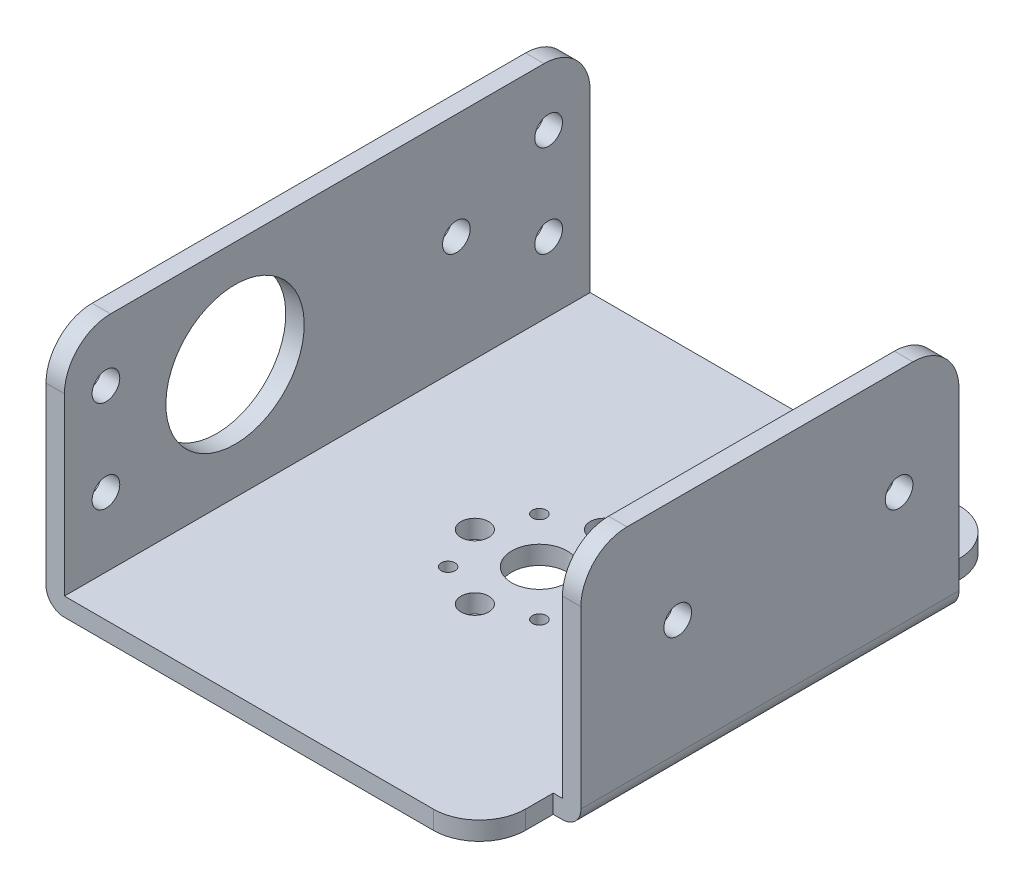
from build123d import *

# Parameters (mm, degrees)
EXTRUDE_1_DEPTH     = 57
SKETCH_2_R          = 7.5
SKETCH_2_R_2        = 1.5
CUT_EXTRUDE_1_DEPTH = 27
SKETCH_3_R          = 1.5
CUT_EXTRUDE_2_DEPTH = 10
SKETCH_4_R          = 1.5
SKETCH_4_R_2        = 3
SKETCH_4_R_3        = 0.75
CUT_EXTRUDE_3_DEPTH = 10
SKETCH_5_R          = 1.5
CUT_EXTRUDE_4_DEPTH = 3
FILLET_2_R          = 2
SKETCH_6_W          = 3
SKETCH_6_H          = 8
CUT_EXTRUDE_5_DEPTH = 44
FILLET_3_R          = 5


with BuildPart() as part:
    # 草图1 → 凸台-拉伸1 (new body)
    with BuildSketch(Plane.XY):
        Polygon((0, 0), (0, -26), (50, -26), (50, 0), (48, 0), (48, -24), (2, -24), (2, 0), align=None)
    extrude(amount=EXTRUDE_1_DEPTH)

    # 草图2 → 切除-拉伸1 (cut)
    with BuildSketch(Plane.ZY):
        with Locations(Location((38.5, -11.5, 0), (0, 0, 270))):
            Circle(SKETCH_2_R)
        with Locations(Location((14.5, -11.5, 0), (0, 0, 270))):
            Circle(SKETCH_2_R_2)
    extrude(amount=-CUT_EXTRUDE_1_DEPTH, mode=Mode.SUBTRACT)

    # 草图3 → 切除-拉伸2 (cut)
    with BuildSketch(Plane(origin=(2, 0, 0), x_dir=(0, 0, -1), z_dir=(1, 0, 0))):
        with Locations(Location((-4.5, -6.5, 0), (0, 0, 90))):
            Circle(SKETCH_3_R)
        with Locations(Location((-4.5, -16.5, 0), (0, 0, 90))):
            Circle(SKETCH_3_R)
        with Locations(Location((-52.5, -16.5, 0), (0, 0, 90))):
            Circle(SKETCH_3_R)
        with Locations(Location((-52.5, -6.5, 0), (0, 0, 90))):
            Circle(SKETCH_3_R)
    extrude(amount=-CUT_EXTRUDE_2_DEPTH, mode=Mode.SUBTRACT)

    # 草图4 → 切除-拉伸3 (cut)
    with BuildSketch(Plane(origin=(0, -24, 0), x_dir=(1, 0, 0), z_dir=(0, 1, 0))):
        with Locations(Location((18, -28.5, 0), (0, 0, 270))):
            Circle(SKETCH_4_R)
        with Locations(Location((25, -21.5, 0), (0, 0, 270))):
            Circle(SKETCH_4_R)
        with Locations(Location((32, -28.5, 0), (0, 0, 270))):
            Circle(SKETCH_4_R)
        with Locations(Location((25, -35.5, 0), (0, 0, 270))):
            Circle(SKETCH_4_R)
        with Locations(Location((25, -28.5, 0), (0, 0, 270))):
            Circle(SKETCH_4_R_2)
        with Locations(Location((20.050252532, -23.550252532, 0), (0, 0, 270))):
            Circle(SKETCH_4_R_3)
        with Locations(Location((29.949747468, -23.550252532, 0), (0, 0, 270))):
            Circle(SKETCH_4_R_3)
        with Locations(Location((29.949747468, -33.449747468, 0), (0, 0, 270))):
            Circle(SKETCH_4_R_3)
        with Locations(Location((20.050252532, -33.449747468, 0), (0, 0, 270))):
            Circle(SKETCH_4_R_3)
    extrude(amount=-CUT_EXTRUDE_3_DEPTH, mode=Mode.SUBTRACT)

    # 草图5 → 切除-拉伸4 (cut)
    with BuildSketch(Plane.ZY.offset(-48)):
        with Locations(Location((14.5, -11.5, 0), (0, 0, 270))):
            Circle(SKETCH_5_R)
        with Locations(Location((38.5, -11.5, 0), (0, 0, 270))):
            Circle(SKETCH_5_R)
    extrude(amount=-CUT_EXTRUDE_4_DEPTH, mode=Mode.SUBTRACT)

    # 圆角2
    fillet_2_edges = [part.edges().sort_by_distance(p)[0] for p in [
        (50, -26, 28.5),
        (0, -26, 28.5),
    ]]
    fillet(fillet_2_edges, radius=FILLET_2_R)

    # 草图6 → 切除-拉伸5 (cut)
    with BuildSketch(Plane.XZ.offset(26)):
        with Locations((48.5, 53)):
            Rectangle(SKETCH_6_W, SKETCH_6_H)
        with Locations((48.5, 4)):
            Rectangle(SKETCH_6_W, SKETCH_6_H)
    extrude(amount=-CUT_EXTRUDE_5_DEPTH, mode=Mode.SUBTRACT)

    # 圆角3
    fillet_3_edges = [part.edges().sort_by_distance(p)[0] for p in [
        (1, 0, 0),
        (47, -25, 57),
        (49, 0, 49),
        (47, -25, 0),
        (49, 0, 8),
        (1, 0, 57),
    ]]
    fillet(fillet_3_edges, radius=FILLET_3_R)


solid = part.part
